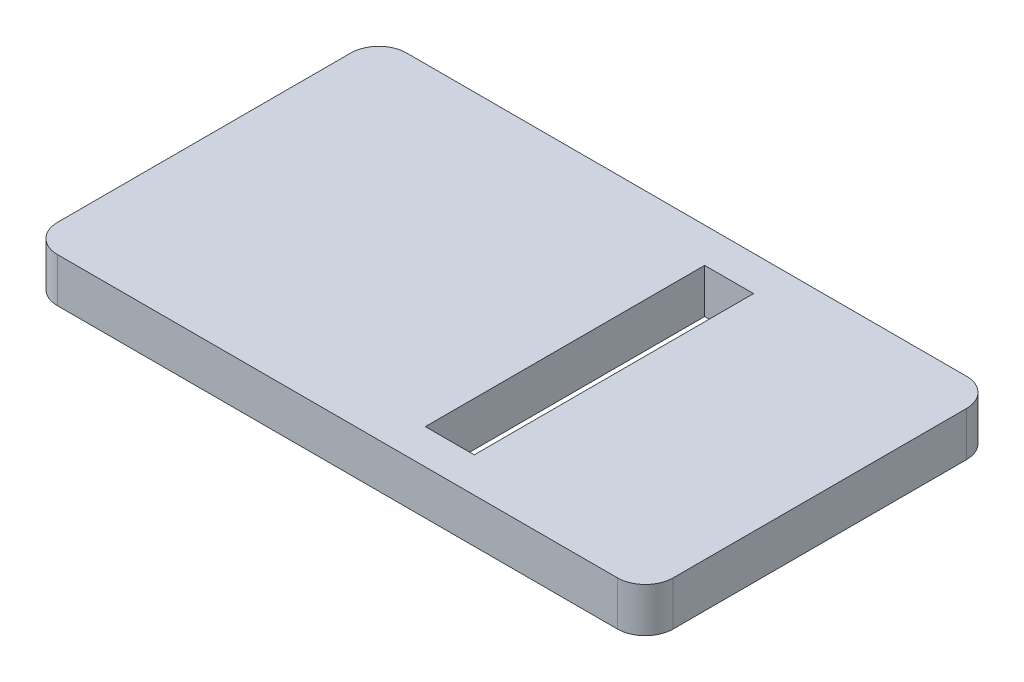
from build123d import *

# Parameters (mm, degrees)
SKETCH1_W           = 88.18
SKETCH1_H           = 50
SKETCH1_W_2         = 7
SKETCH1_H_2         = 40
BOSS_EXTRUDE1_DEPTH = 6.35
FILLET1_R           = 4


with BuildPart() as part:
    # Sketch1 → Boss-Extrude1 (new body)
    with BuildSketch(Plane(origin=(0, 0, 0), x_dir=(1, 0, 0), z_dir=(0, 1, 0))):
        Rectangle(SKETCH1_W, SKETCH1_H)
        with Locations((11.09, 0)):
            Rectangle(SKETCH1_W_2, SKETCH1_H_2, mode=Mode.SUBTRACT)
    extrude(amount=BOSS_EXTRUDE1_DEPTH)

    # Fillet1
    fillet1_edges = [part.edges().sort_by_distance(p)[0] for p in [
        (44.09, 3.175, 25),
        (-44.09, 3.175, 25),
        (-44.09, 3.175, -25),
        (44.09, 3.175, -25),
    ]]
    fillet(fillet1_edges, radius=FILLET1_R)


solid = part.part
